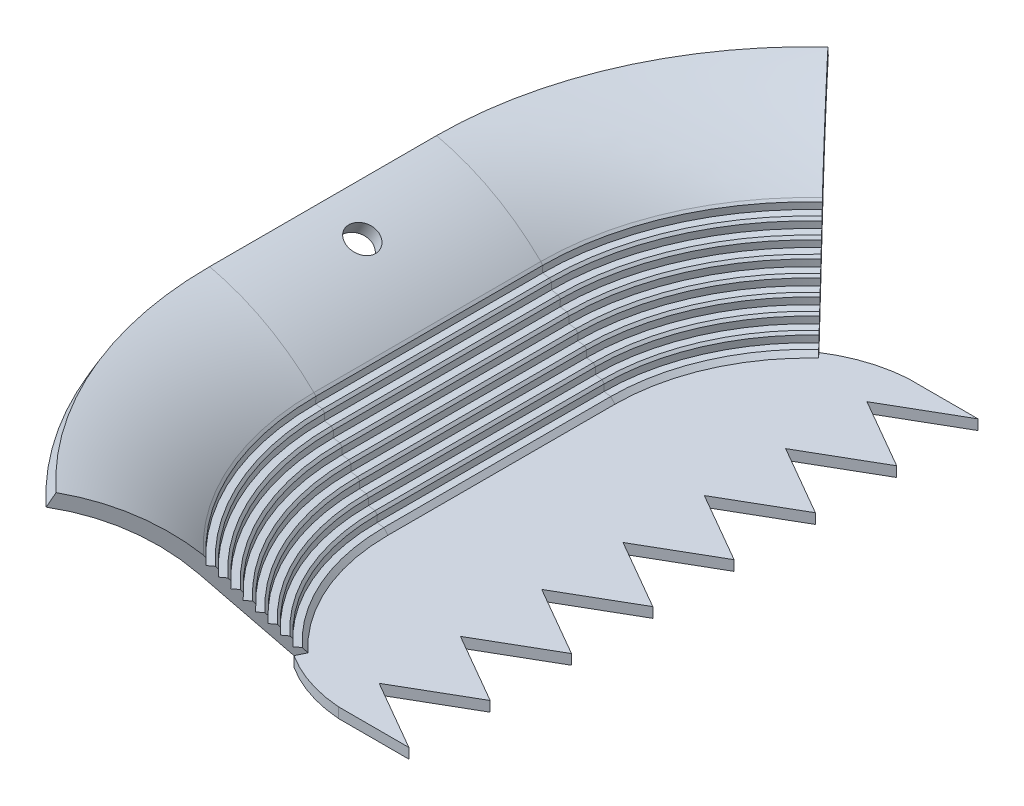
from build123d import *

# Parameters (mm, degrees)
BOSS_EXTRUDE1_DEPTH = 6.665
CUT_EXTRUDE2_DEPTH  = 26.439635203
LPATTERN1_COUNT     = 8
LPATTERN1_PITCH     = 1.33
BOSS_EXTRUDE2_DEPTH = 1
SKETCH11_R          = 1.425
CUT_EXTRUDE4_DEPTH  = 72.832856437


with BuildPart() as part:
    # Sketch1 → Boss-Extrude1 (new, symmetric)
    with BuildSketch(Plane.XY):
        with BuildLine():
            Line((-5.635928665, 7.156958206), (1, 0))
            Line((1, 0), (1.978038604, 0.208423819))
            Line((1.978038604, 0.208423819), (-5.306204433, 8.736958206))
            ThreePointArc((-5.306204433, 8.736958206), (-10.044936575, 12.250309514), (-15.564524684, 14.33198356))
            Line((-15.564524684, 14.33198356), (-16.250550344, 13.11))
            ThreePointArc((-16.250550344, 13.11), (-10.479442469, 10.960456342), (-5.635928665, 7.156958206))
        make_face()
    extrude(amount=BOSS_EXTRUDE1_DEPTH, both=True)

    # Sketch2 → Cut-Extrude2 (cut, symmetric)
    with BuildSketch(Plane.XY.offset(6.665)):
        Polygon((-3.982294286, 46.704559607), (-5.111367134, 8.50883888), (-5.131163815, 7.839131413), (-4.46660252, 7.753935845), (33.435614326, 2.894939498), (91.54886787, 52.52961802), (54.130959258, 96.339238129), align=None)
    cut_extrude2 = extrude(amount=CUT_EXTRUDE2_DEPTH, both=True, mode=Mode.SUBTRACT)

    # LPattern1: Cut-Extrude2 ×8
    with Locations(*[Vector(0.6494576652092012, -0.7603977519042342, 0) * (i * LPATTERN1_PITCH) for i in range(1, LPATTERN1_COUNT)]):
        add(cut_extrude2, mode=Mode.SUBTRACT)

    # Sweep1: sweep along a path in Sketch5
    with BuildLine(Plane(origin=(0, 0, 0), x_dir=(1, 0, 0), z_dir=(0, 1, 0))) as sweep1_path:
        Line((1, -6.665), (1, -11.165))
        ThreePointArc((1, -11.165), (2.66969722, -19.165), (7.4, -25.829242224))
    # Sketch3 → Sweep1 (sweep)
    with BuildSketch(Plane.XY.offset(6.665)):
        with BuildLine():
            Line((-5.111367134, 8.50883888), (-5.306204433, 8.736958206))
            ThreePointArc((-5.306204433, 8.736958206), (-10.044936575, 12.250309514), (-15.564524684, 14.33198356))
            Line((-15.564524684, 14.33198356), (-16.250550344, 13.11))
            ThreePointArc((-16.250550344, 13.11), (-10.479442469, 10.960456342), (-5.635928665, 7.156958206))
            Line((-5.635928665, 7.156958206), (1, 0))
            Line((1, 0), (1.978038604, 0.208423819))
            Line((1.978038604, 0.208423819), (1.579848343, 0.674632774))
            Line((1.579848343, 0.674632774), (0.915287048, 0.759828343))
            Line((0.915287048, 0.759828343), (0.935083729, 1.42953581))
            Line((0.935083729, 1.42953581), (0.716069648, 1.685961784))
            Line((0.716069648, 1.685961784), (0.051508353, 1.771157353))
            Line((0.051508353, 1.771157353), (0.071305034, 2.44086482))
            Line((0.071305034, 2.44086482), (-0.147709047, 2.697290795))
            Line((-0.147709047, 2.697290795), (-0.812270342, 2.782486363))
            Line((-0.812270342, 2.782486363), (-0.79247366, 3.45219383))
            Line((-0.79247366, 3.45219383), (-1.011487741, 3.708619805))
            Line((-1.011487741, 3.708619805), (-1.676049036, 3.793815373))
            Line((-1.676049036, 3.793815373), (-1.656252355, 4.46352284))
            Line((-1.656252355, 4.46352284), (-1.875266436, 4.719948815))
            Line((-1.875266436, 4.719948815), (-2.539827731, 4.805144383))
            Line((-2.539827731, 4.805144383), (-2.52003105, 5.47485185))
            Line((-2.52003105, 5.47485185), (-2.739045131, 5.731277825))
            Line((-2.739045131, 5.731277825), (-3.403606426, 5.816473393))
            Line((-3.403606426, 5.816473393), (-3.383809744, 6.48618086))
            Line((-3.383809744, 6.48618086), (-3.602823825, 6.742606835))
            Line((-3.602823825, 6.742606835), (-4.267385121, 6.827802403))
            Line((-4.267385121, 6.827802403), (-4.247588439, 7.49750987))
            Line((-4.247588439, 7.49750987), (-4.46660252, 7.753935845))
            Line((-4.46660252, 7.753935845), (-5.131163815, 7.839131413))
            Line((-5.131163815, 7.839131413), (-5.111367134, 8.50883888))
        make_face()
    sweep1 = sweep(path=sweep1_path.line)

    # Mirror1: Sweep1 across plane
    add(sweep1.mirror(Plane.XY))

    # Sketch11 → Cut-Extrude4 (cut, through all)
    with BuildSketch(Plane(origin=(-18.047616148, -32.18946836, 0), x_dir=(-0.8722573757239734, 0.48904710457697953, 0), z_dir=(-0.4890471045769795, -0.8722573757239733, 0))):
        with Locations(Location((16.586069938, 0, 0), (0, 0, 180))):
            Circle(SKETCH11_R)
    extrude(amount=-CUT_EXTRUDE4_DEPTH, mode=Mode.SUBTRACT)


with BuildPart() as body_2:
    # Sketch9 → Boss-Extrude2 (new body)
    with BuildSketch(Plane(origin=(0, 0, 0), x_dir=(1, 0, 0), z_dir=(0, 1, 0))):
        with BuildLine():
            Line((13.949642027, -24), (20.877845257, -20))
            Line((20.877845257, -20), (13.949642027, -16))
            Line((13.949642027, -16), (20.877845257, -12))
            Line((20.877845257, -12), (13.949642027, -8))
            Line((13.949642027, -8), (20.877845257, -4))
            Line((20.877845257, -4), (13.949642027, 0))
            Line((13.949642027, 0), (20.877845257, 4))
            Line((20.877845257, 4), (13.949642027, 8))
            Line((13.949642027, 8), (20.877845257, 12))
            Line((20.877845257, 12), (13.949642027, 16))
            Line((13.949642027, 16), (20.877845257, 20))
            Line((20.877845257, 20), (13.949642027, 24))
            Line((13.949642027, 24), (20.877845257, 28))
            Line((20.877845257, 28), (13.949642027, 28))
            ThreePointArc((13.949642027, 28), (10.538992417, 27.324445134), (7.4, 25.829242224))
            ThreePointArc((7.4, 25.829242224), (2.66969722, 19.165), (1, 11.165))
            Line((1, 11.165), (1, -11.165))
            ThreePointArc((1, -11.165), (2.66969722, -19.165), (7.4, -25.829242224))
            ThreePointArc((7.4, -25.829242224), (10.538992417, -27.324445134), (13.949642027, -28))
            Line((13.949642027, -28), (20.877845257, -28))
            Line((20.877845257, -28), (13.949642027, -24))
        make_face()
    extrude(amount=-BOSS_EXTRUDE2_DEPTH)


solid = Compound([part.part, body_2.part])
